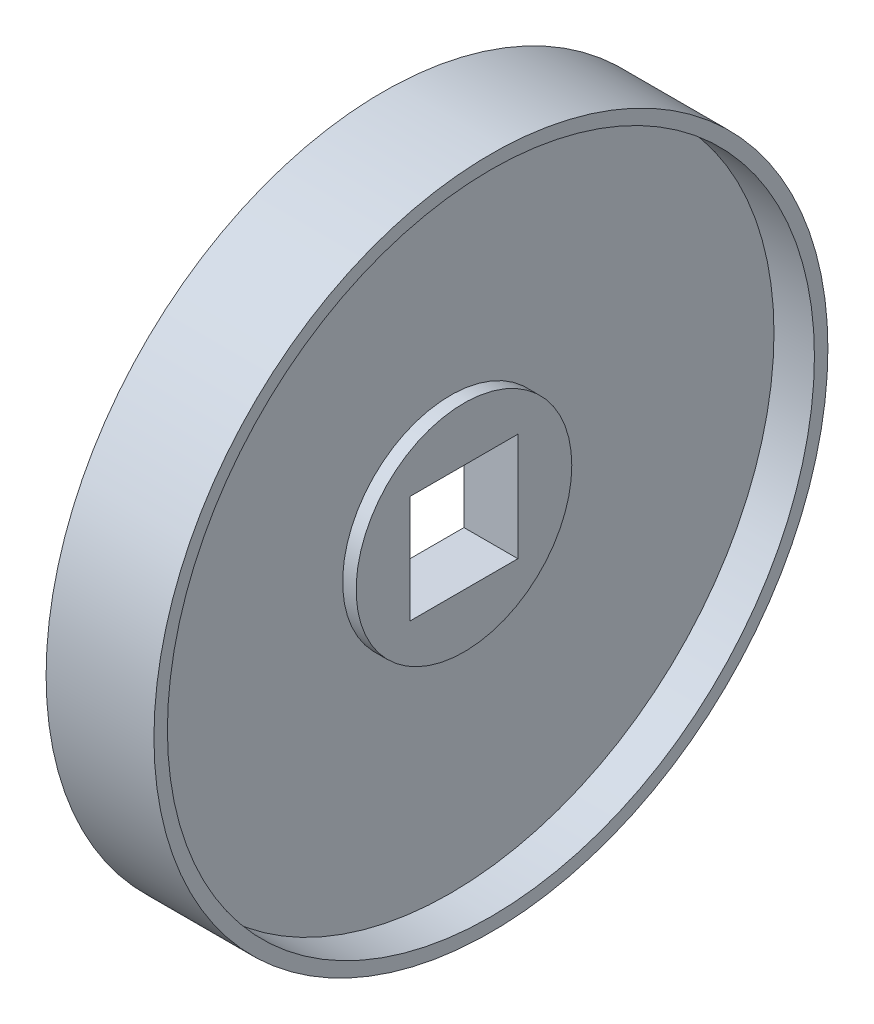
from build123d import *

# Parameters (mm, degrees)
SKETCH1_W               = 6.35
SKETCH1_H               = 50.8
SKETCH1_W_2             = 12.7
SKETCH1_H_2             = 25.4
SKETCH1_W_3             = 25.4
SKETCH1_H_3             = 3.175
CUT_EXTRUDE1_DEPTH      = 114.858173839
CUT_EXTRUDE1_DEPTH_BACK = 114.858173839
SKETCH2_W               = 25.4
SKETCH2_H               = 25.4


with BuildPart() as part:
    # Sketch1 → Revolve1 (revolve)
    with BuildSketch(Plane(origin=(0, 0, 0), x_dir=(1, 0, 0), z_dir=(0, 1, 0))):
        with Locations((0, 50.8)):
            Rectangle(SKETCH1_W, SKETCH1_H)
        with Locations((0, 12.7)):
            Rectangle(SKETCH1_W_2, SKETCH1_H_2)
        with Locations((0, 77.7875)):
            Rectangle(SKETCH1_W_3, SKETCH1_H_3)
    revolve(axis=Axis((6.35, 0, 0), (-1, 0, 0)))

    # Sketch2 → Cut-Extrude1 (cut, two sides: drawn at the far end of the back side and taken through both)
    with BuildSketch(Plane(origin=(6.35, 0, 0), x_dir=(0, 0, -1), z_dir=(1, 0, 0)).offset(-CUT_EXTRUDE1_DEPTH_BACK)):
        Rectangle(SKETCH2_W, SKETCH2_H)
    extrude(amount=CUT_EXTRUDE1_DEPTH + CUT_EXTRUDE1_DEPTH_BACK, mode=Mode.SUBTRACT)


solid = part.part
